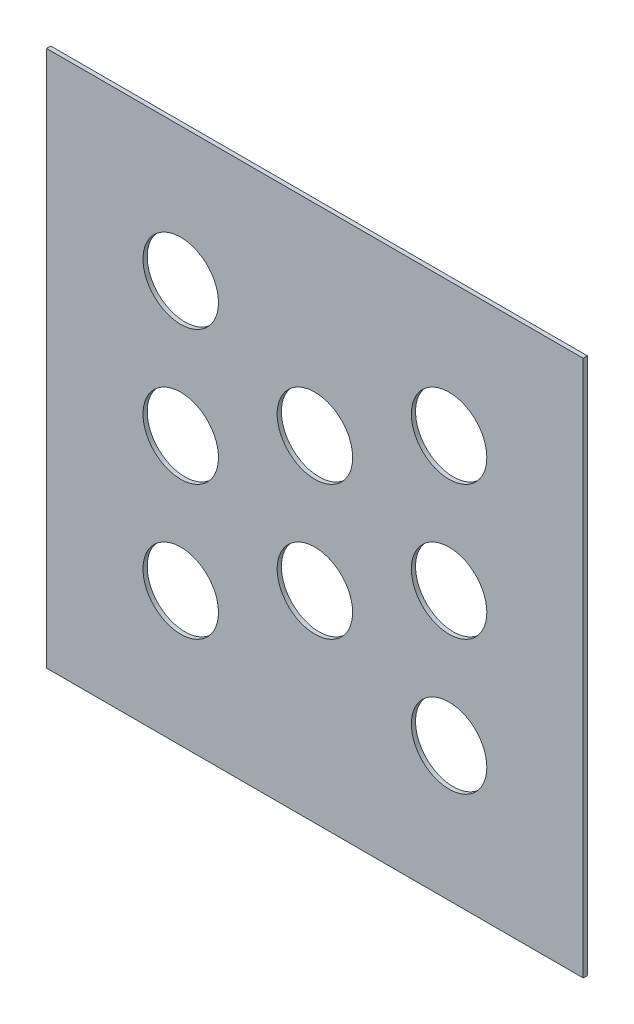
from build123d import *

# Parameters (mm, degrees)
SKETCH1_W           = 203.2
SKETCH1_H           = 203.2
SKETCH1_R           = 14.2875
BOSS_EXTRUDE1_DEPTH = 1.5875


with BuildPart() as part:
    # Sketch1 → Boss-Extrude1 (new body)
    with BuildSketch(Plane.XY):
        with Locations((101.6, -101.6)):
            Rectangle(SKETCH1_W, SKETCH1_H)
        with Locations((152.4, -101.6)):
            Circle(SKETCH1_R, mode=Mode.SUBTRACT)
        with Locations((152.4, -50.8)):
            Circle(SKETCH1_R, mode=Mode.SUBTRACT)
        with Locations((101.6, -76.2)):
            Circle(SKETCH1_R, mode=Mode.SUBTRACT)
        with Locations((152.4, -152.4)):
            Circle(SKETCH1_R, mode=Mode.SUBTRACT)
        with Locations((50.8, -50.8)):
            Circle(SKETCH1_R, mode=Mode.SUBTRACT)
        with Locations((50.8, -101.6)):
            Circle(SKETCH1_R, mode=Mode.SUBTRACT)
        with Locations((50.8, -152.4)):
            Circle(SKETCH1_R, mode=Mode.SUBTRACT)
        with Locations((101.6, -127)):
            Circle(SKETCH1_R, mode=Mode.SUBTRACT)
    extrude(amount=BOSS_EXTRUDE1_DEPTH)


solid = part.part
